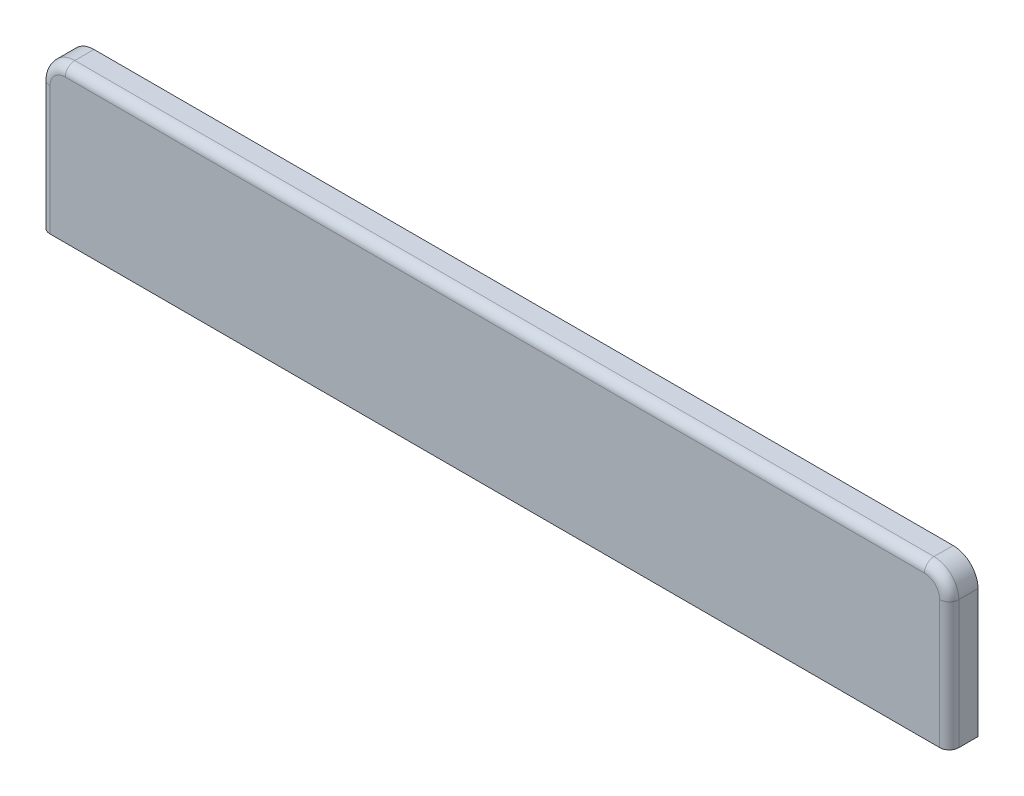
from build123d import *

# Parameters (mm, degrees)
SKETCH1_W           = 603.25
SKETCH1_H           = 101.6
BOSS_EXTRUDE1_DEPTH = 19.05
FILLET1_R           = 16.51
FILLET2_R           = 6.35


with BuildPart() as part:
    # Sketch1 → Boss-Extrude1 (new body)
    with BuildSketch(Plane.XY):
        with Locations((0, 50.8)):
            Rectangle(SKETCH1_W, SKETCH1_H)
    extrude(amount=BOSS_EXTRUDE1_DEPTH)

    # Fillet1
    fillet1_edges = [part.edges().sort_by_distance(p)[0] for p in [
        (301.625, 101.6, 9.525),
        (-301.625, 101.6, 9.525),
    ]]
    fillet(fillet1_edges, radius=FILLET1_R)

    # Fillet2
    fillet2_edges = [part.edges().sort_by_distance(p)[0] for p in [
        (301.625, 42.545, 19.05),
        (-301.625, 42.545, 19.05),
        (0, 101.6, 19.05),
        (296.789332957, 96.764332957, 19.05),
        (-296.789332957, 96.764332957, 19.05),
    ]]
    fillet(fillet2_edges, radius=FILLET2_R)


solid = part.part
